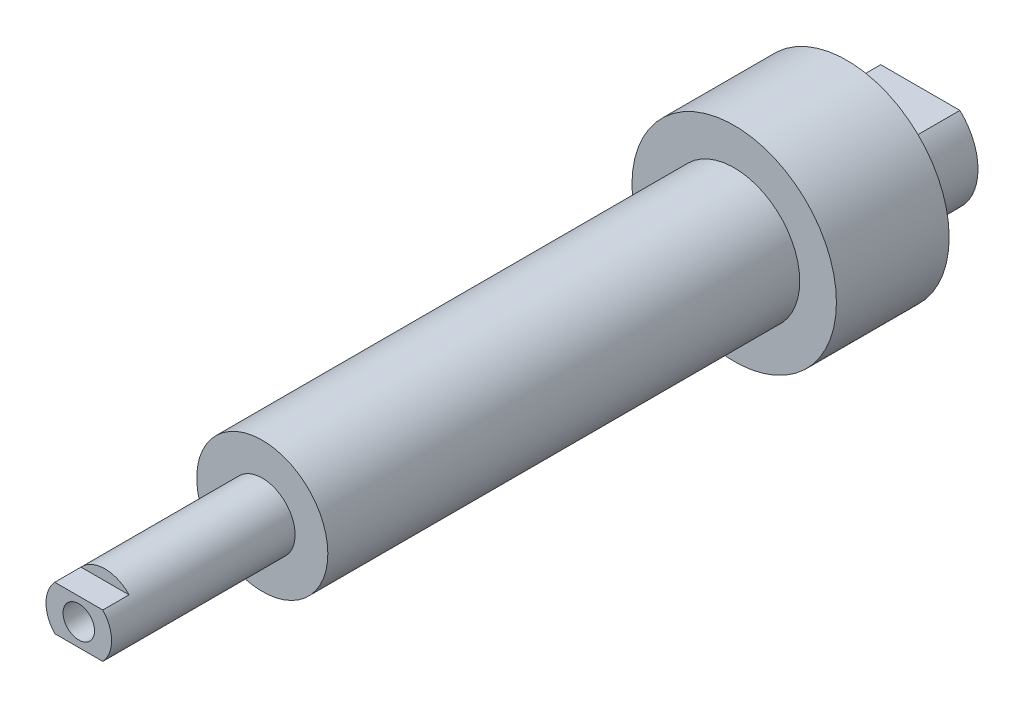
from build123d import *

# Parameters (mm, degrees)
SKETCH1_R               = 39
BOSS_EXTRUDE1_DEPTH     = 321
SKETCH2_OUTSIDE_W       = 147.884
SKETCH2_OUTSIDE_H       = 147.884
SKETCH2_OUTSIDE_R       = 25
CUT_EXTRUDE1_DEPTH      = 250
SKETCH3_OUTSIDE_W       = 147.884
SKETCH3_OUTSIDE_H       = 147.884
SKETCH3_OUTSIDE_R       = 22
CUT_EXTRUDE2_DEPTH      = 28
SKETCH4_R               = 13
CUT_EXTRUDE3_DEPTH      = 91
CUT_EXTRUDE4_DEPTH      = 326.703853216
CUT_EXTRUDE4_DEPTH_BACK = 25
CUT_EXTRUDE5_DEPTH      = 326.703853216
CUT_EXTRUDE5_DEPTH_BACK = 25
SKETCH7_OUTSIDE_W       = 147.884
SKETCH7_OUTSIDE_H       = 147.884
SKETCH7_OUTSIDE_R       = 12.5
CUT_EXTRUDE6_DEPTH      = 70
CUT_EXTRUDE7_DEPTH      = 326.703853216
CUT_EXTRUDE7_DEPTH_BACK = 10
CUT_EXTRUDE8_DEPTH      = 326.703853216
CUT_EXTRUDE8_DEPTH_BACK = 10
SKETCH10_R              = 6
CUT_EXTRUDE9_DEPTH      = 326.703853216


with BuildPart() as part:
    # Sketch1 → Boss-Extrude1 (new body)
    with BuildSketch(Plane.XY):
        Circle(SKETCH1_R)
    extrude(amount=BOSS_EXTRUDE1_DEPTH)

    # Sketch2 outside → Cut-Extrude1 (cut)
    with BuildSketch(Plane.XY.offset(321)):
        Rectangle(SKETCH2_OUTSIDE_W, SKETCH2_OUTSIDE_H)
        Circle(SKETCH2_OUTSIDE_R, mode=Mode.SUBTRACT)
    extrude(amount=-CUT_EXTRUDE1_DEPTH, mode=Mode.SUBTRACT)

    # Sketch3 outside → Cut-Extrude2 (cut)
    with BuildSketch(Plane(origin=(0, 0, 0), x_dir=(-1, 0, 0), z_dir=(0, 0, -1))):
        Rectangle(SKETCH3_OUTSIDE_W, SKETCH3_OUTSIDE_H)
        Circle(SKETCH3_OUTSIDE_R, mode=Mode.SUBTRACT)
    extrude(amount=-CUT_EXTRUDE2_DEPTH, mode=Mode.SUBTRACT)

    # Sketch4 → Cut-Extrude3 (cut)
    with BuildSketch(Plane(origin=(0, 0, 0), x_dir=(-1, 0, 0), z_dir=(0, 0, -1))):
        Circle(SKETCH4_R)
    extrude(amount=-CUT_EXTRUDE3_DEPTH, mode=Mode.SUBTRACT)

    # Sketch5 → Cut-Extrude4 (cut, two sides: drawn at the far end of the back side and taken through both)
    with BuildSketch(Plane(origin=(0, 0, 0), x_dir=(-1, 0, 0), z_dir=(0, 0, -1)).offset(-CUT_EXTRUDE4_DEPTH_BACK)):
        Polygon((179.395153858, -16), (15.099668871, -16), (-15.099668871, -16), (-179.395153858, -16), (-179.395153858, -344.590969976), (179.395153858, -344.590969976), align=None)
    extrude(amount=CUT_EXTRUDE4_DEPTH + CUT_EXTRUDE4_DEPTH_BACK, mode=Mode.SUBTRACT)

    # Sketch6 → Cut-Extrude5 (cut, two sides: drawn at the far end of the back side and taken through both)
    with BuildSketch(Plane(origin=(0, 0, 0), x_dir=(-1, 0, 0), z_dir=(0, 0, -1)).offset(-CUT_EXTRUDE5_DEPTH_BACK)):
        Polygon((179.395153858, 16), (15.099668871, 16), (-15.099668871, 16), (-179.395153858, 16), (-179.395153858, 344.590969976), (179.395153858, 344.590969976), align=None)
    extrude(amount=CUT_EXTRUDE5_DEPTH + CUT_EXTRUDE5_DEPTH_BACK, mode=Mode.SUBTRACT)

    # Sketch7 outside → Cut-Extrude6 (cut)
    with BuildSketch(Plane.XY.offset(321)):
        Rectangle(SKETCH7_OUTSIDE_W, SKETCH7_OUTSIDE_H)
        Circle(SKETCH7_OUTSIDE_R, mode=Mode.SUBTRACT)
    extrude(amount=-CUT_EXTRUDE6_DEPTH, mode=Mode.SUBTRACT)

    # Sketch8 → Cut-Extrude7 (cut, two sides: drawn at the far end of the back side and taken through both)
    with BuildSketch(Plane.XY.offset(321).offset(-CUT_EXTRUDE7_DEPTH_BACK)):
        Polygon((-154.459376077, 8.5), (-9.16515139, 8.5), (9.16515139, 8.5), (154.459376077, 8.5), (154.459376077, 299.088449374), (-154.459376077, 299.088449374), align=None)
    extrude(amount=CUT_EXTRUDE7_DEPTH + CUT_EXTRUDE7_DEPTH_BACK, mode=Mode.SUBTRACT)

    # Sketch9 → Cut-Extrude8 (cut, two sides: drawn at the far end of the back side and taken through both)
    with BuildSketch(Plane.XY.offset(321).offset(-CUT_EXTRUDE8_DEPTH_BACK)):
        Polygon((-154.459376077, -8.5), (-9.16515139, -8.5), (9.16515139, -8.5), (154.459376077, -8.5), (154.459376077, -299.088449374), (-154.459376077, -299.088449374), align=None)
    extrude(amount=CUT_EXTRUDE8_DEPTH + CUT_EXTRUDE8_DEPTH_BACK, mode=Mode.SUBTRACT)

    # Sketch10 → Cut-Extrude9 (cut, through all)
    with BuildSketch(Plane.XY.offset(321)):
        Circle(SKETCH10_R)
    extrude(amount=-CUT_EXTRUDE9_DEPTH, mode=Mode.SUBTRACT)


solid = part.part
